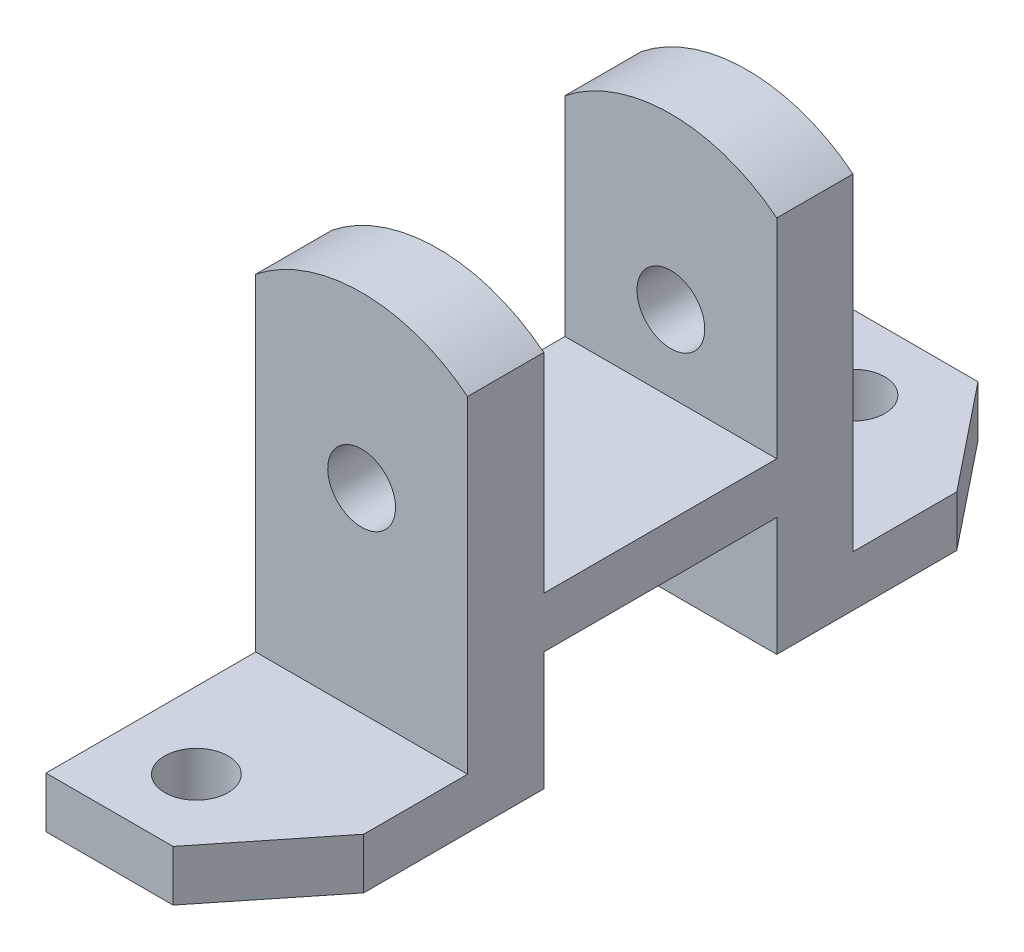
from build123d import *
from OCP.BRepFilletAPI import BRepFilletAPI_MakeChamfer

# Parameters (mm, degrees)
BOSS_EXTRUDE1_DEPTH     = 25
CHAMFER1_SIZE           = 20
CHAMFER1_SIZE2          = 25
CUT_EXTRUDE1_DEPTH      = 155.043013474
CUT_EXTRUDE1_DEPTH_BACK = 155.043013474
SKETCH2_R               = 8
SKETCH4_R               = 7.5
CUT_EXTRUDE2_DEPTH      = 131.560330882
SKETCH6_W               = 8
SKETCH6_H               = 55
BOSS_EXTRUDE2_DEPTH     = 28


with BuildPart() as part:
    # Sketch1 → Boss-Extrude1 (new, symmetric)
    with BuildSketch(Plane(origin=(0, 0, 0), x_dir=(0, 0, -1), z_dir=(1, 0, 0))):
        Polygon((-95, -40), (-27.5, -40), (-27.5, -12), (27.5, -12), (27.5, -40), (95, -40), (95, -28), (45.5, -28), (45.5, 58), (27.5, 58), (27.5, 0), (-27.5, 0), (-27.5, 58), (-45.5, 58), (-45.5, -28), (-95, -28), align=None)
    extrude(amount=BOSS_EXTRUDE1_DEPTH, both=True)

    # Chamfer1: one chamfer whose edges measure the first distance from different faces: ONE call of the kernel's chamfer builder (chamfer() names one face for all edges)
    chamfer1_edges_1 = [part.edges().sort_by_distance(p)[0] for p in [
        (25, -34, 95),
    ]]
    chamfer1_side_1 = [part.faces().sort_by_distance(p)[0] for p in [
        (0, -34, 95),
    ]]
    chamfer1_edges_2 = [part.edges().sort_by_distance(p)[0] for p in [
        (25, -34, -95),
    ]]
    chamfer1_side_2 = [part.faces().sort_by_distance(p)[0] for p in [
        (0, -34, -95),
    ]]
    chamfer1 = BRepFilletAPI_MakeChamfer(part.part.solid().wrapped)
    for e in chamfer1_edges_1:
        chamfer1.Add(CHAMFER1_SIZE, CHAMFER1_SIZE2, e.wrapped, chamfer1_side_1[0].wrapped)  # the first distance lies on this face
    for e in chamfer1_edges_2:
        chamfer1.Add(CHAMFER1_SIZE, CHAMFER1_SIZE2, e.wrapped, chamfer1_side_2[0].wrapped)  # the first distance lies on this face
    add(Compound.cast(chamfer1.Shape()), mode=Mode.REPLACE)

    # Sketch2 → Cut-Extrude1 (cut, two sides: drawn at the far end of the back side and taken through both)
    with BuildSketch(Plane(origin=(0, 0, -45.5), x_dir=(-1, 0, 0), z_dir=(0, 0, -1)).offset(-CUT_EXTRUDE1_DEPTH_BACK)):
        with Locations(Location((0, 18, 0), (0, 0, 90))):
            Circle(SKETCH2_R)
        with BuildLine():
            Line((0, 58), (-25, 58))
            Line((-25, 58), (-25, 49.224989992))
            ThreePointArc((-25, 49.224989992), (-13.247648854, 55.742546282), (0, 58))
        make_face()
        with BuildLine():
            Line((25, 58), (0, 58))
            ThreePointArc((0, 58), (13.247648854, 55.742546282), (25, 49.224989992))
            Line((25, 49.224989992), (25, 58))
        make_face()
    extrude(amount=CUT_EXTRUDE1_DEPTH + CUT_EXTRUDE1_DEPTH_BACK, mode=Mode.SUBTRACT)

    # Sketch4 → Cut-Extrude2 (cut, through all)
    with BuildSketch(Plane(origin=(0, -28, 0), x_dir=(1, 0, 0), z_dir=(0, 1, 0))):
        with Locations(Location((-7, -77.5, 0), (0, 0, 270))):
            Circle(SKETCH4_R)
        with Locations(Location((-7, 77.5, 0), (0, 0, 270))):
            Circle(SKETCH4_R)
    extrude(amount=-CUT_EXTRUDE2_DEPTH, mode=Mode.SUBTRACT)

    # Sketch6 → Boss-Extrude2 (add)
    with BuildSketch(Plane.XZ.offset(40)):
        with Locations((-7, 0)):
            Rectangle(SKETCH6_W, SKETCH6_H)
    extrude(amount=-BOSS_EXTRUDE2_DEPTH)


solid = part.part
